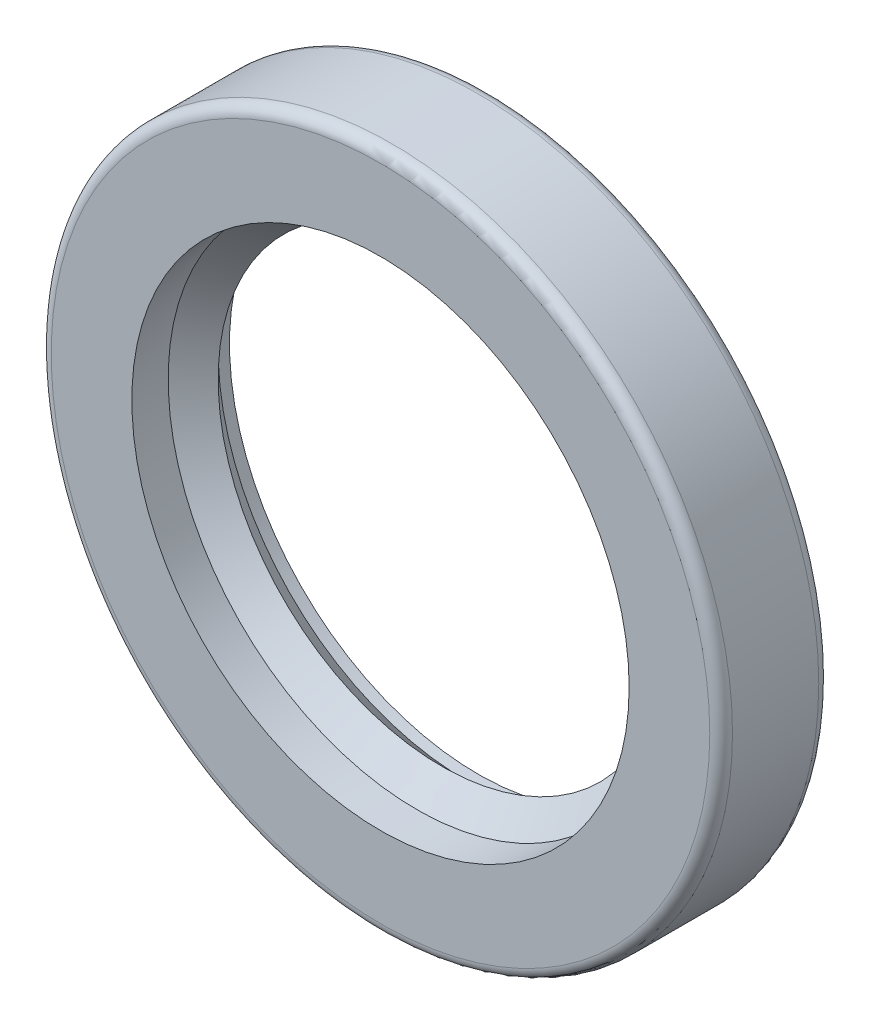
from build123d import *


with BuildPart() as part:
    # Sketch1 → Revolve1 (revolve)
    with BuildSketch(Plane(origin=(0, 0, 0), x_dir=(0, 0, -1), z_dir=(1, 0, 0)), mode=Mode.PRIVATE) as revolve1_sk:
        with BuildLine():
            Line((0, 13.9065), (0, 18.415))
            ThreePointArc((0, 18.415), (0.185987194, 18.864012806), (0.635, 19.05))
            Line((0.635, 19.05), (5.461, 19.05))
            ThreePointArc((5.461, 19.05), (5.910012806, 18.864012806), (6.096, 18.415))
            Line((6.096, 18.415), (6.096, 17.145))
            Line((6.096, 17.145), (2.032, 17.145))
            Line((2.032, 17.145), (2.032, 15.24))
            Line((2.032, 15.24), (2.413, 15.24))
            ThreePointArc((2.413, 15.24), (3.429, 16.256), (4.445, 15.24))
            Line((4.445, 15.24), (5.461, 15.24))
            Line((5.461, 15.24), (5.461, 13.9065))
            Line((5.461, 13.9065), (4.826, 13.9065))
            Line((4.826, 13.9065), (3.429, 12.5095))
            Line((3.429, 12.5095), (2.032, 13.9065))
            Line((2.032, 13.9065), (0, 13.9065))
        make_face()
    revolve(revolve1_sk.sketch.rotate(Axis((0, 0, 0), (0, 0, -1)), 90), axis=Axis((0, 0, 0), (0, 0, -1)))


solid = part.part
